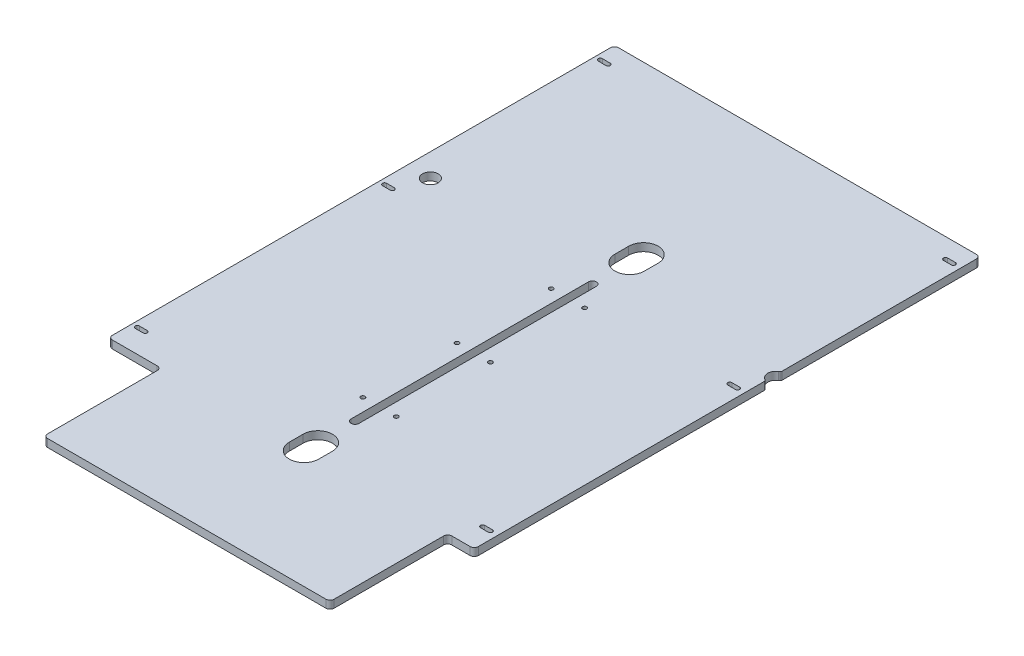
from build123d import *

# Parameters (mm, degrees)
BOSS_EXTRUDE1_DEPTH = 12.7
FILLET1_R           = 6.604
FILLET2_R           = 6.604
SKETCH2_R           = 12.7
CUT_EXTRUDE1_DEPTH  = 1020.273904858
CUT_EXTRUDE3_DEPTH  = 1020.273904858
CUT_EXTRUDE4_DEPTH  = 1020.273904858
SKETCH6_R           = 3.3782
CUT_EXTRUDE5_DEPTH  = 1020.273904858
CUT_EXTRUDE6_DEPTH  = 1020.273904858
CUT_EXTRUDE7_DEPTH  = 1019.820731075
FILLET3_R           = 2.54


with BuildPart() as part:
    # Sketch1 → Boss-Extrude1 (new body)
    with BuildSketch(Plane(origin=(0, 0, 0), x_dir=(1, 0, 0), z_dir=(0, 1, 0))):
        Polygon((0, 0), (96.04375, 0), (96.04375, -190.5), (559.59375, -190.5), (559.59375, 0), (606.425, 0), (606.425, 819.15), (0, 819.15), align=None)
        with BuildLine():
            Line((19.05, 41.4782), (31.75, 41.4782))
            ThreePointArc((31.75, 41.4782), (35.1282, 38.1), (31.75, 34.7218))
            Line((31.75, 34.7218), (19.05, 34.7218))
            ThreePointArc((19.05, 34.7218), (15.6718, 38.1), (19.05, 41.4782))
        make_face(mode=Mode.SUBTRACT)
        with BuildLine():
            Line((19.05, 441.5282), (31.75, 441.5282))
            ThreePointArc((31.75, 441.5282), (35.1282, 438.15), (31.75, 434.7718))
            Line((31.75, 434.7718), (19.05, 434.7718))
            ThreePointArc((19.05, 434.7718), (15.6718, 438.15), (19.05, 441.5282))
        make_face(mode=Mode.SUBTRACT)
        with BuildLine():
            Line((31.75, 784.0218), (19.05, 784.0218))
            ThreePointArc((19.05, 784.0218), (15.6718, 787.4), (19.05, 790.7782))
            Line((19.05, 790.7782), (31.75, 790.7782))
            ThreePointArc((31.75, 790.7782), (35.1282, 787.4), (31.75, 784.0218))
        make_face(mode=Mode.SUBTRACT)
        with BuildLine():
            Line((577.85, 784.0218), (590.55, 784.0218))
            ThreePointArc((590.55, 784.0218), (593.9282, 787.4), (590.55, 790.7782))
            Line((590.55, 790.7782), (577.85, 790.7782))
            ThreePointArc((577.85, 790.7782), (574.4718, 787.4), (577.85, 784.0218))
        make_face(mode=Mode.SUBTRACT)
        with BuildLine():
            Line((590.55, 441.5282), (577.85, 441.5282))
            ThreePointArc((577.85, 441.5282), (574.4718, 438.15), (577.85, 434.7718))
            Line((577.85, 434.7718), (590.55, 434.7718))
            ThreePointArc((590.55, 434.7718), (593.9282, 438.15), (590.55, 441.5282))
        make_face(mode=Mode.SUBTRACT)
        with BuildLine():
            Line((590.55, 41.4782), (577.85, 41.4782))
            ThreePointArc((577.85, 41.4782), (574.4718, 38.1), (577.85, 34.7218))
            Line((577.85, 34.7218), (590.55, 34.7218))
            ThreePointArc((590.55, 34.7218), (593.9282, 38.1), (590.55, 41.4782))
        make_face(mode=Mode.SUBTRACT)
    extrude(amount=BOSS_EXTRUDE1_DEPTH)

    # Fillet1
    fillet1_edges = [part.edges().sort_by_distance(p)[0] for p in [
        (559.59375, 6.35, 0),
        (96.04375, 6.35, 0),
    ]]
    fillet(fillet1_edges, radius=FILLET1_R)

    # Fillet2
    fillet2_edges = [part.edges().sort_by_distance(p)[0] for p in [
        (0, 6.35, -819.15),
        (606.425, 6.35, -819.15),
        (606.425, 6.35, 0),
        (559.59375, 6.35, 190.5),
        (96.04375, 6.35, 190.5),
        (0, 6.35, 0),
    ]]
    fillet(fillet2_edges, radius=FILLET2_R)

    # Sketch2 → Cut-Extrude1 (cut, through all)
    with BuildSketch(Plane(origin=(0, 12.7, 0), x_dir=(1, 0, 0), z_dir=(0, 1, 0))):
        with Locations(Location((47.625, 483.87, 0), (0, 0, 270))):
            Circle(SKETCH2_R)
        with BuildLine():
            Line((606.425, 505.867045256), (606.425, 461.872954744))
            ThreePointArc((606.425, 461.872954744), (604.723522628, 468.222954744), (600.075, 472.871477372))
            ThreePointArc((600.075, 472.871477372), (593.725, 483.87), (600.075, 494.868522628))
            ThreePointArc((600.075, 494.868522628), (604.723522628, 499.517045256), (606.425, 505.867045256))
        make_face()
    extrude(amount=-CUT_EXTRUDE1_DEPTH, mode=Mode.SUBTRACT)

    # Sketch4 → Cut-Extrude3 (cut, through all)
    with BuildSketch(Plane.XZ):
        with BuildLine():
            Line((350.8375, -527.05), (350.8375, -549.275))
            ThreePointArc((350.8375, -549.275), (327.025, -573.0875), (303.2125, -549.275))
            Line((303.2125, -549.275), (303.2125, -527.05))
            ThreePointArc((303.2125, -527.05), (327.025, -503.2375), (350.8375, -527.05))
        make_face()
        with BuildLine():
            Line((350.8375, 0), (350.8375, -22.225))
            ThreePointArc((350.8375, -22.225), (327.025, -46.0375), (303.2125, -22.225))
            Line((303.2125, -22.225), (303.2125, 0))
            ThreePointArc((303.2125, 0), (327.025, 23.8125), (350.8375, 0))
        make_face()
    extrude(amount=-CUT_EXTRUDE3_DEPTH, mode=Mode.SUBTRACT)

    # Sketch5 → Cut-Extrude4 (cut, through all)
    with BuildSketch(Plane.XZ):
        with BuildLine():
            Line((320.675, -466.725), (320.675, -82.55))
            ThreePointArc((320.675, -82.55), (327.025, -76.2), (333.375, -82.55))
            Line((333.375, -82.55), (333.375, -466.725))
            ThreePointArc((333.375, -466.725), (327.025, -473.075), (320.675, -466.725))
        make_face()
    extrude(amount=-CUT_EXTRUDE4_DEPTH, mode=Mode.SUBTRACT)

    # Sketch6 → Cut-Extrude5 (cut, through all)
    with BuildSketch(Plane.XZ):
        with Locations(Location((354.0125, -274.6375, 0), (0, 0, 270))):
            Circle(SKETCH6_R)
        with Locations(Location((354.0125, -427.0375, 0), (0, 0, 270))):
            Circle(SKETCH6_R)
        with Locations(Location((354.0125, -122.2375, 0), (0, 0, 90))):
            Circle(SKETCH6_R)
        with Locations(Location((300.0375, -427.0375, 0), (0, 0, 90))):
            Circle(SKETCH6_R)
        with Locations(Location((300.0375, -274.6375, 0), (0, 0, 90))):
            Circle(SKETCH6_R)
        with Locations(Location((300.0375, -122.2375, 0), (0, 0, 270))):
            Circle(SKETCH6_R)
    extrude(amount=-CUT_EXTRUDE5_DEPTH, mode=Mode.SUBTRACT)

    # Sketch7 → Cut-Extrude6 (cut, through all)
    with BuildSketch(Plane.XZ):
        with BuildLine():
            ThreePointArc((605.663, -812.546), (603.728733183, -817.215733183), (599.059, -819.15))
            Line((599.059, -819.15), (599.821, -819.15))
            ThreePointArc((599.821, -819.15), (604.490733183, -817.215733183), (606.425, -812.546))
            Line((606.425, -812.546), (606.425, -505.867045256))
            ThreePointArc((606.425, -505.867045256), (604.723522628, -499.517045256), (600.075, -494.868522628))
            ThreePointArc((600.075, -494.868522628), (604.165699913, -498.959222541), (605.663, -504.547222541))
            Line((605.663, -504.547222541), (605.663, -812.546))
        make_face()
        with BuildLine():
            ThreePointArc((0.762, -812.546), (2.696266817, -817.215733183), (7.366, -819.15))
            Line((7.366, -819.15), (6.604, -819.15))
            ThreePointArc((6.604, -819.15), (1.934266817, -817.215733183), (0, -812.546))
            Line((0, -812.546), (0, -6.604))
            ThreePointArc((0, -6.604), (1.934266817, -1.934266817), (6.604, 0))
            Line((6.604, 0), (7.366, 0))
            ThreePointArc((7.366, 0), (2.696266817, -1.934266817), (0.762, -6.604))
            Line((0.762, -6.604), (0.762, -812.546))
        make_face()
        with BuildLine():
            ThreePointArc((605.663, -462.330859906), (604.07096336, -468.487413325), (599.694, -473.100429953))
            ThreePointArc((599.694, -473.100429953), (599.883498256, -472.98428666), (600.075, -472.871477372))
            ThreePointArc((600.075, -472.871477372), (604.723522628, -468.222954744), (606.425, -461.872954744))
            Line((606.425, -461.872954744), (606.425, -6.604))
            ThreePointArc((606.425, -6.604), (604.490733183, -1.934266817), (599.821, 0))
            Line((599.821, 0), (599.059, 0))
            ThreePointArc((599.059, 0), (603.728733183, -1.934266817), (605.663, -6.604))
            Line((605.663, -6.604), (605.663, -462.330859906))
        make_face()
    extrude(amount=-CUT_EXTRUDE6_DEPTH, mode=Mode.SUBTRACT)

    # Sketch8 → Cut-Extrude7 (cut, through all)
    with BuildSketch(Plane.XZ):
        with BuildLine():
            Line((0.762, -6.604), (0.762, -812.546))
            ThreePointArc((0.762, -812.546), (2.696266817, -817.215733183), (7.366, -819.15))
            Line((7.366, -819.15), (16.891, -819.15))
            ThreePointArc((16.891, -819.15), (12.221266817, -817.215733183), (10.287, -812.546))
            Line((10.287, -812.546), (10.287, -6.604))
            ThreePointArc((10.287, -6.604), (12.221266817, -1.934266817), (16.891, 0))
            Line((16.891, 0), (7.366, 0))
            ThreePointArc((7.366, 0), (2.696266817, -1.934266817), (0.762, -6.604))
        make_face()
        with BuildLine():
            Line((605.663, -6.604), (605.663, -812.546))
            ThreePointArc((605.663, -812.546), (603.728733183, -817.215733183), (599.059, -819.15))
            Line((599.059, -819.15), (595.884, -819.15))
            ThreePointArc((595.884, -819.15), (600.553733183, -817.215733183), (602.488, -812.546))
            Line((602.488, -812.546), (602.488, -6.604))
            ThreePointArc((602.488, -6.604), (600.553733183, -1.934266817), (595.884, 0))
            Line((595.884, 0), (599.059, 0))
            ThreePointArc((599.059, 0), (603.728733183, -1.934266817), (605.663, -6.604))
        make_face()
    extrude(amount=-CUT_EXTRUDE7_DEPTH, mode=Mode.SUBTRACT)

    # Fillet3
    fillet3_edges = [part.edges().sort_by_distance(p)[0] for p in [
        (602.488, 6.35, -470.731120318),
        (602.488, 6.35, -496.744211904),
    ]]
    fillet(fillet3_edges, radius=FILLET3_R)


solid = part.part
